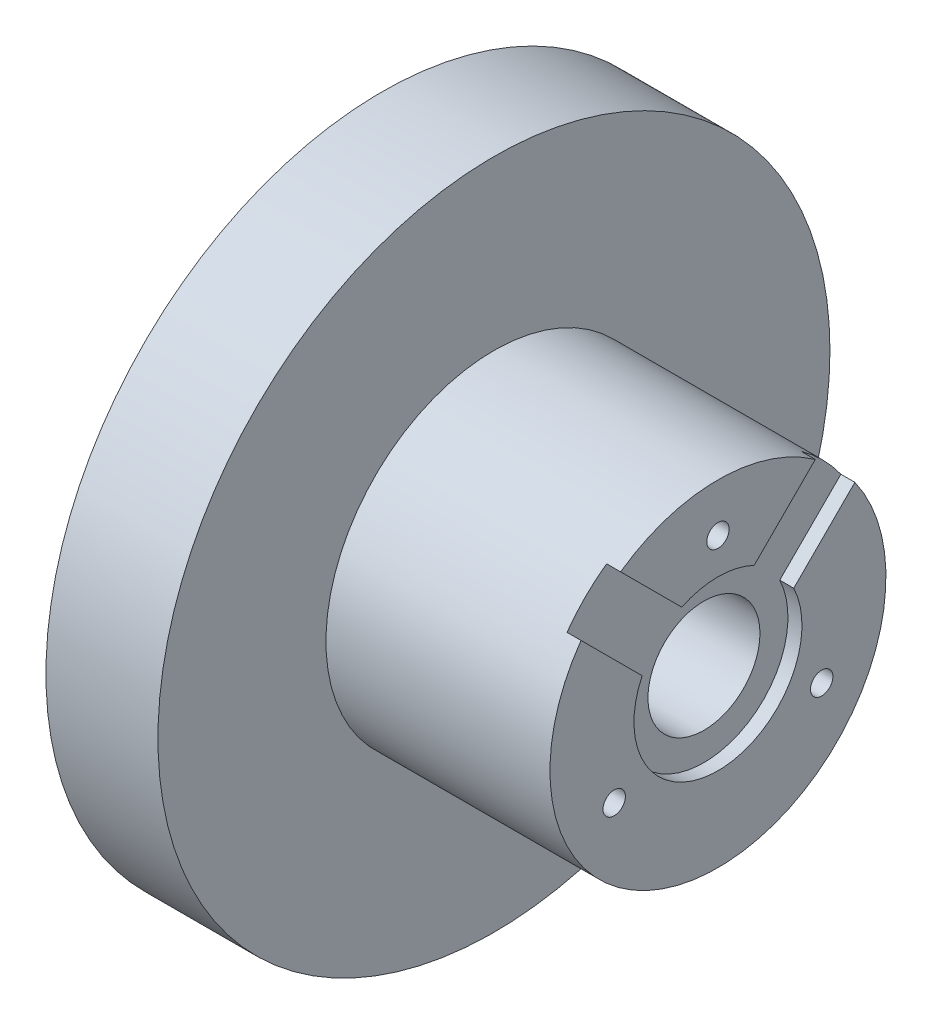
from build123d import *

# Parameters (mm, degrees)
SKETCH1_R           = 38.1
BOSS_EXTRUDE1_DEPTH = 12.7
SKETCH2_R           = 19.05
BOSS_EXTRUDE2_DEPTH = 25.4
SKETCH3_R           = 6.35
CUT_EXTRUDE1_DEPTH  = 66.991135768
SKETCH4_R           = 1.27
CUT_EXTRUDE2_DEPTH  = 6.35
SKETCH5_R           = 9.525
CUT_EXTRUDE3_DEPTH  = 1.5875


with BuildPart() as part:
    # Sketch1 → Boss-Extrude1 (new body)
    with BuildSketch(Plane(origin=(0, 0, 0), x_dir=(0, 0, -1), z_dir=(1, 0, 0))):
        Circle(SKETCH1_R)
    extrude(amount=BOSS_EXTRUDE1_DEPTH)

    # Sketch2 → Boss-Extrude2 (add)
    with BuildSketch(Plane(origin=(12.7, 0, 0), x_dir=(0, 0, -1), z_dir=(1, 0, 0))):
        Circle(SKETCH2_R)
    extrude(amount=BOSS_EXTRUDE2_DEPTH)

    # Sketch3 → Cut-Extrude1 (cut, through all)
    with BuildSketch(Plane(origin=(38.1, 0, 0), x_dir=(0, 0, -1), z_dir=(1, 0, 0))):
        Circle(SKETCH3_R)
    extrude(amount=-CUT_EXTRUDE1_DEPTH, mode=Mode.SUBTRACT)

    # Sketch4 → Cut-Extrude2 (cut)
    with BuildSketch(Plane(origin=(38.1, 0, 0), x_dir=(0, 0, -1), z_dir=(1, 0, 0))):
        with Locations((0, 13.583482333)):
            Circle(SKETCH4_R)
        with Locations((11.763640772, -6.791741166)):
            Circle(SKETCH4_R)
        with Locations((-11.763640772, -6.791741166)):
            Circle(SKETCH4_R)
    extrude(amount=-CUT_EXTRUDE2_DEPTH, mode=Mode.SUBTRACT)

    # Sketch5 → Cut-Extrude3 (cut)
    with BuildSketch(Plane(origin=(38.1, 0, 0), x_dir=(0, 0, -1), z_dir=(1, 0, 0))):
        Circle(SKETCH5_R)
        Polygon((-15.715448212, 11.225320151), (-11.225320151, 15.715448212), (2.24506403, 2.24506403), (-2.24506403, -2.24506403), align=None)
        Polygon((15.715448212, 11.225320151), (2.24506403, -2.24506403), (-2.24506403, 2.24506403), (11.225320151, 15.715448212), align=None)
    extrude(amount=-CUT_EXTRUDE3_DEPTH, mode=Mode.SUBTRACT)


solid = part.part
